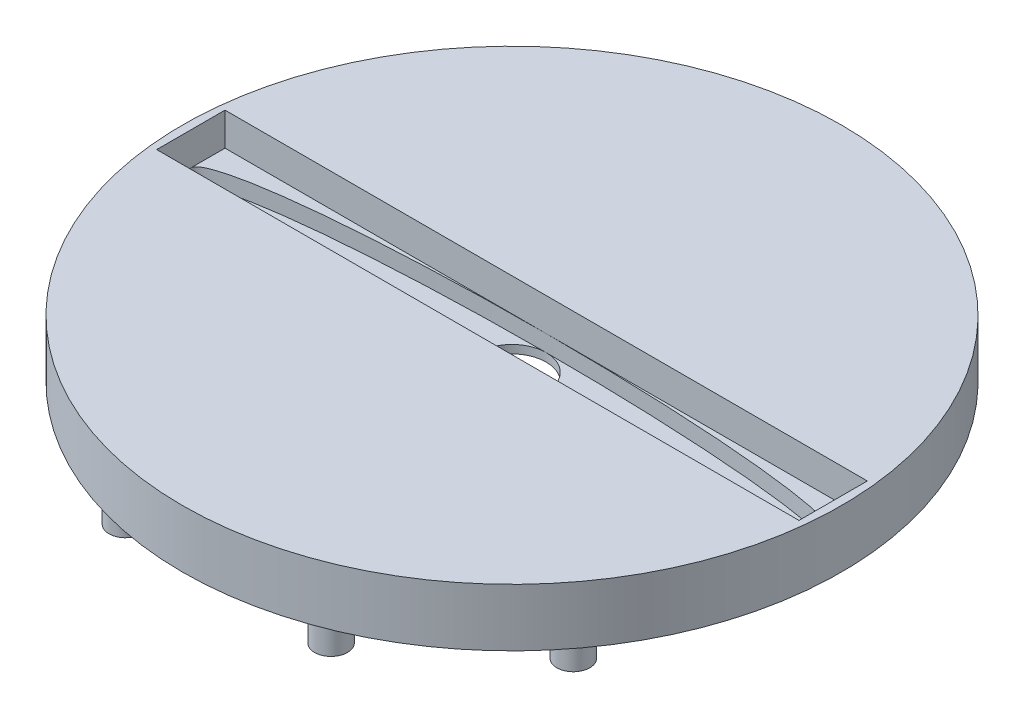
from build123d import *

# Parameters (mm, degrees)
SKETCH_9_R           = 40.020028018
EXTRUDE_3_DEPTH      = 7
EXTRUDE_4_DEPTH      = 7
EXTRUDE_4_DEPTH_BACK = 4
SKETCH_9_3_R         = 2
SKETCH_10_W          = 78
SKETCH_10_H          = 8.3
CUT_EXTRUDE_4_DEPTH  = 4
SKETCH_12_RX         = 39
SKETCH_12_RY         = 4.15
CUT_EXTRUDE_6_DEPTH  = 2
SKETCH_13_R          = 4.15
CUT_EXTRUDE_7_DEPTH  = 57.914016597


with BuildPart() as part:
    # 草图9 → 凸台-拉伸3 (new body)
    with BuildSketch(Plane(origin=(0, 0, 0), x_dir=(1, 0, 0), z_dir=(0, 1, 0))):
        Circle(SKETCH_9_R)
        with BuildLine():
            ThreePointArc((-27.585789036, -23.066203122), (-30.407992627, -22.550065759), (-29.810498329, -19.743959658))
            ThreePointArc((-29.810498329, -19.743959658), (-27.778871949, -19.686725751), (-26.746176582, -21.437246172))
            ThreePointArc((-26.746176582, -21.437246172), (-26.968428696, -22.353549864), (-27.585789036, -23.066203122))
        make_face(mode=Mode.SUBTRACT)
        with BuildLine():
            ThreePointArc((-10.596443163, -35.12129407), (-13.203413531, -36.31918237), (-14.325449842, -33.678677608))
            ThreePointArc((-14.325449842, -33.678677608), (-12.086387614, -32.493377831), (-10.481803809, -34.453899709))
            ThreePointArc((-10.481803809, -34.453899709), (-10.51067199, -34.792484046), (-10.596443163, -35.12129407))
        make_face(mode=Mode.SUBTRACT)
        with BuildLine():
            ThreePointArc((14.482594231, -34.454465093), (12.821133927, -36.425604579), (10.597203357, -35.121774056))
            ThreePointArc((10.597203357, -35.121774056), (11.761068998, -32.589149748), (14.326275376, -33.679326501))
            ThreePointArc((14.326275376, -33.679326501), (14.443125064, -34.059093299), (14.482594231, -34.454465093))
        make_face(mode=Mode.SUBTRACT)
        with BuildLine():
            ThreePointArc((30.804113616, -21.353828271), (29.722993149, -23.130246128), (27.648453212, -22.986142282))
            ThreePointArc((27.648453212, -22.986142282), (27.139078544, -20.245830883), (29.863522136, -19.657463456))
            ThreePointArc((29.863522136, -19.657463456), (30.553230113, -20.383987315), (30.804113616, -21.353828271))
        make_face(mode=Mode.SUBTRACT)
    extrude(amount=EXTRUDE_3_DEPTH)

    # 草图9<3> → 凸台-拉伸4 (add, two sides: drawn at the far end of the back side and taken through both)
    with BuildSketch(Plane(origin=(0, 0, 0), x_dir=(1, 0, 0), z_dir=(0, 1, 0)).offset(-EXTRUDE_4_DEPTH_BACK)):
        with Locations((-28.746176582, -21.437246172)):
            Circle(SKETCH_9_3_R)
        with Locations((28.804113616, -21.353828271)):
            Circle(SKETCH_9_3_R)
        with Locations((12.482594231, -34.454465093)):
            Circle(SKETCH_9_3_R)
        with Locations((-12.481803809, -34.453899709)):
            Circle(SKETCH_9_3_R)
    extrude(amount=EXTRUDE_4_DEPTH + EXTRUDE_4_DEPTH_BACK)

    # 草图10 → 切除-拉伸4 (cut)
    with BuildSketch(Plane(origin=(0, 7, 0), x_dir=(1, 0, 0), z_dir=(0, 1, 0))):
        Rectangle(SKETCH_10_W, SKETCH_10_H)
    extrude(amount=-CUT_EXTRUDE_4_DEPTH, mode=Mode.SUBTRACT)

    # 草图12 → 切除-拉伸6 (cut)
    with BuildSketch(Plane(origin=(0, 3, 0), x_dir=(1, 0, 0), z_dir=(0, 1, 0))):
        with Locations(Location((0, 0), (0, 0, 0))):
            Ellipse(SKETCH_12_RX, SKETCH_12_RY)
    extrude(amount=-CUT_EXTRUDE_6_DEPTH, mode=Mode.SUBTRACT)

    # 草图13 → 切除-拉伸7 (cut, through all)
    with BuildSketch(Plane(origin=(0, 1, 0), x_dir=(1, 0, 0), z_dir=(0, 1, 0))):
        Circle(SKETCH_13_R)
    extrude(amount=-CUT_EXTRUDE_7_DEPTH, mode=Mode.SUBTRACT)


solid = part.part
